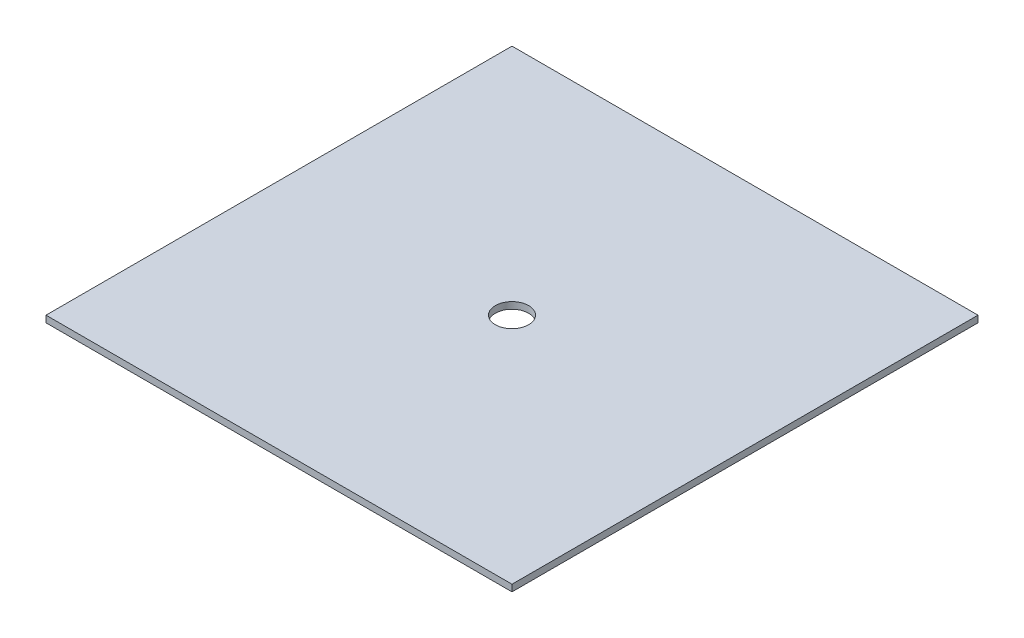
from build123d import *

# Parameters (mm, degrees)
SKETCH6_W           = 350
SKETCH6_H           = 350
SKETCH6_R           = 12.5
BOSS_EXTRUDE1_DEPTH = 5


with BuildPart() as part:
    # Sketch6 → Boss-Extrude1 (new body)
    with BuildSketch(Plane(origin=(0, 0, 0), x_dir=(1, 0, 0), z_dir=(0, 1, 0))):
        Rectangle(SKETCH6_W, SKETCH6_H)
        with Locations(Location((0, 0, 0), (0, 0, 270))):
            Circle(SKETCH6_R, mode=Mode.SUBTRACT)
    extrude(amount=BOSS_EXTRUDE1_DEPTH)


solid = part.part
